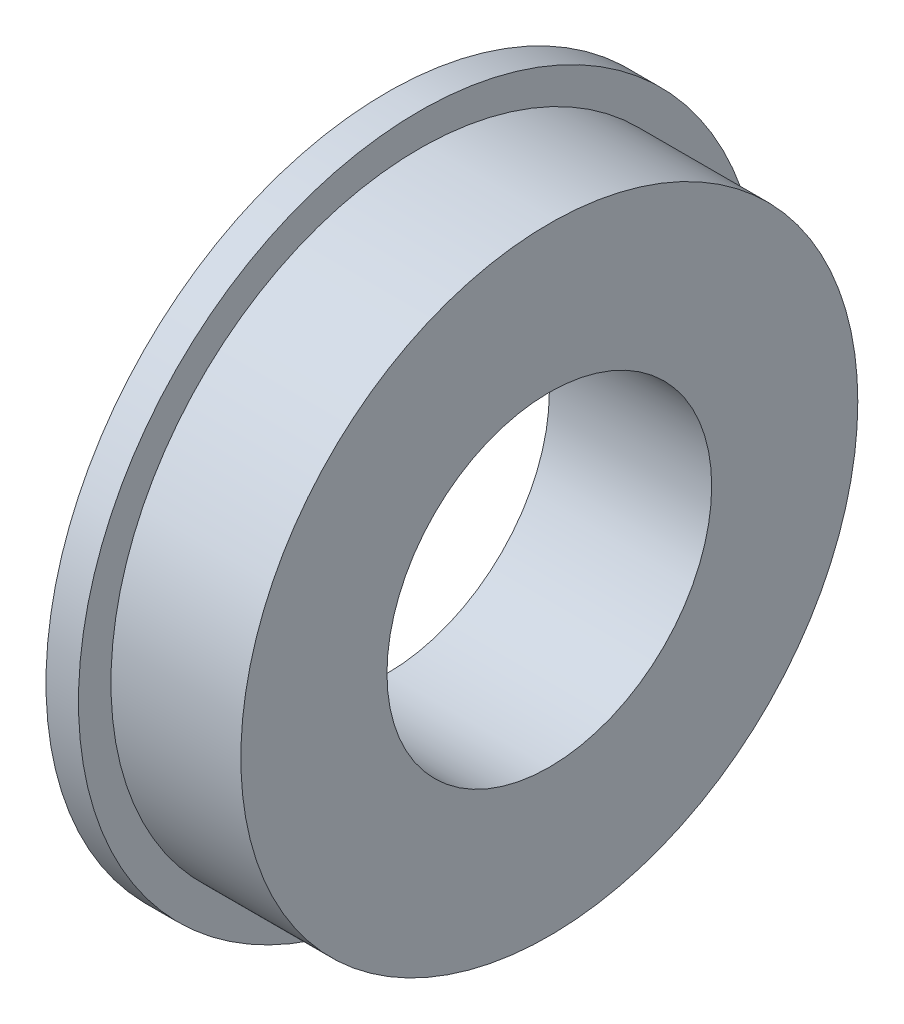
from build123d import *

# Parameters (mm, degrees)
SKETCH_1_R          = 10.5
SKETCH_1_R_2        = 5
EXTRUDE_1_DEPTH     = 5
CUT_EXTRUDE_START   = -4
SKETCH_3_R          = 10.5
SKETCH_3_R_2        = 9.5
CUT_EXTRUDE_1_DEPTH = 4


with BuildPart() as part:
    # 草图1 → 凸台-拉伸1 (new body)
    with BuildSketch(Plane(origin=(0, 0, 0), x_dir=(0, 0, -1), z_dir=(1, 0, 0))):
        Circle(SKETCH_1_R)
        Circle(SKETCH_1_R_2, mode=Mode.SUBTRACT)
    extrude(amount=EXTRUDE_1_DEPTH)

    # 草图3 → 切除-拉伸1 (cut)
    with BuildSketch(Plane(origin=(5, 0, 0), x_dir=(0, 0, -1), z_dir=(1, 0, 0)).offset(CUT_EXTRUDE_START)):
        Circle(SKETCH_3_R)
        Circle(SKETCH_3_R_2, mode=Mode.SUBTRACT)
    extrude(amount=CUT_EXTRUDE_1_DEPTH, mode=Mode.SUBTRACT)


solid = part.part
